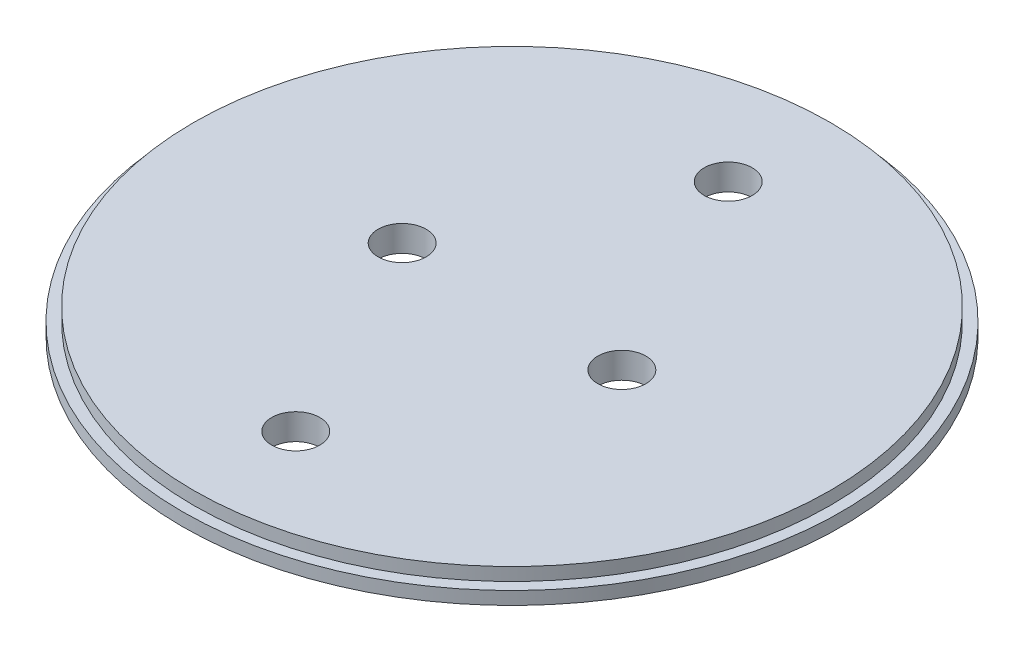
from build123d import *

# Parameters (mm, degrees)
SKETCH1_R           = 73.65
SKETCH1_R_2         = 5.55625
BOSS_EXTRUDE1_DEPTH = 3
BOSS_EXTRUDE2_START = -3
SKETCH1_3_R         = 76.2
SKETCH1_3_R_2       = 5.55625
BOSS_EXTRUDE2_DEPTH = 3


with BuildPart() as part:
    # Sketch1 → Boss-Extrude1 (new body)
    with BuildSketch(Plane(origin=(0, 0, 0), x_dir=(1, 0, 0), z_dir=(0, 1, 0))):
        Circle(SKETCH1_R)
        with Locations((0, -50)):
            Circle(SKETCH1_R_2, mode=Mode.SUBTRACT)
        with Locations((-25.4, 0)):
            Circle(SKETCH1_R_2, mode=Mode.SUBTRACT)
        with Locations((25.4, 0)):
            Circle(SKETCH1_R_2, mode=Mode.SUBTRACT)
        with Locations((0, 50)):
            Circle(SKETCH1_R_2, mode=Mode.SUBTRACT)
    extrude(amount=BOSS_EXTRUDE1_DEPTH)

    # Sketch1<3> → Boss-Extrude2 (add)
    with BuildSketch(Plane(origin=(0, 0, 0), x_dir=(1, 0, 0), z_dir=(0, 1, 0)).offset(BOSS_EXTRUDE2_START)):
        Circle(SKETCH1_3_R)
        with Locations((0, 50)):
            Circle(SKETCH1_3_R_2, mode=Mode.SUBTRACT)
        with Locations((0, -50)):
            Circle(SKETCH1_3_R_2, mode=Mode.SUBTRACT)
        with Locations((-25.4, 0)):
            Circle(SKETCH1_3_R_2, mode=Mode.SUBTRACT)
        with Locations((25.4, 0)):
            Circle(SKETCH1_3_R_2, mode=Mode.SUBTRACT)
    extrude(amount=BOSS_EXTRUDE2_DEPTH)


solid = part.part
